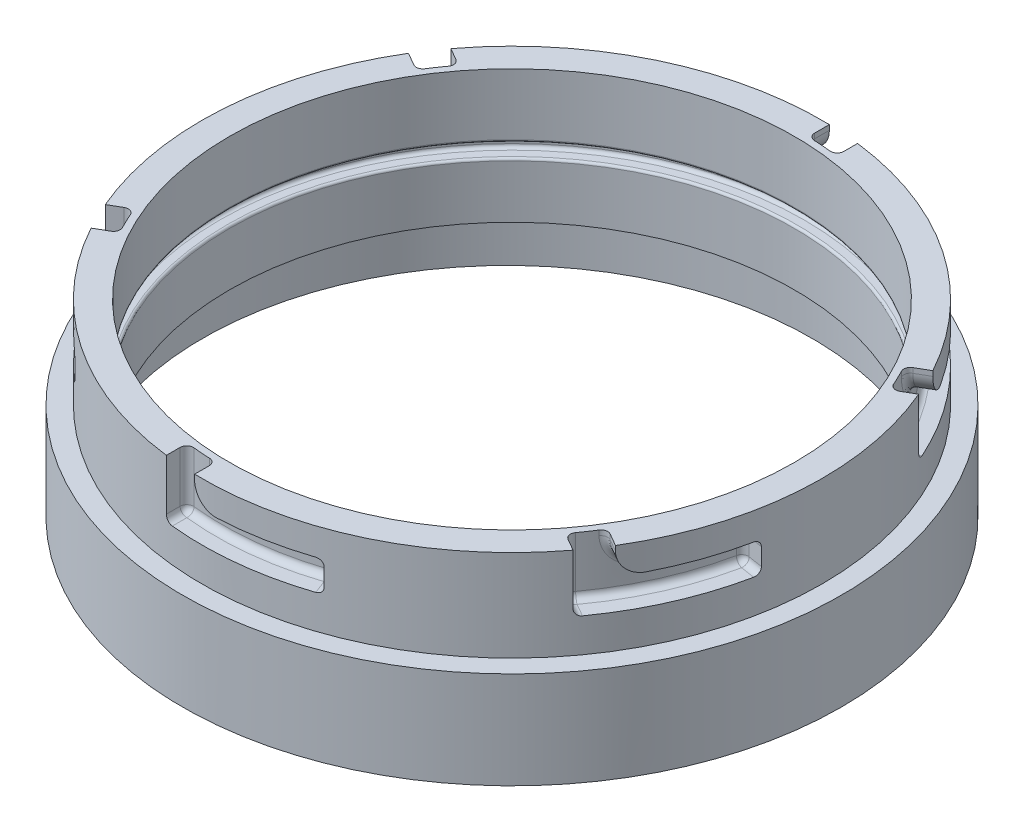
from build123d import *

# Parameters (mm, degrees)
CUT_EXTRUDE1_START       = -13.207999999999998
CUT_EXTRUDE1_DEPTH       = 13.207999999999998
SKETCH10_W               = 4.827435186195032
SKETCH10_H               = 6.984999999999999
FILLET1_R                = 5.08
FILLET7_R                = 1.524
CIRPATTERN1_COUNT        = 6
FILLET1_OF_CIRPATTERN1_R = 5.08
FILLET7_OF_CIRPATTERN1_R = 1.524
FILLET2_R                = 0.762
FILLET3_R                = 0.508
BOSS_EXTRUDE1_START      = 12.7
SKETCH25_R               = 75.565
SKETCH25_R_2             = 69.85
BOSS_EXTRUDE1_DEPTH      = 12.7


with BuildPart() as part:
    # Sketch1 → Revolve1 (revolve)
    with BuildSketch(Plane.XY):
        Polygon((71.11999999999999, 36.51250000000001), (71.11999999999999, 15.557500000000015), (75.56500000000001, 15.557500000000017), (75.565, 6.032500000000017), (64.77000000000001, 6.032500000000014), (64.77000000000001, 18.732500000000012), (67.81799999999998, 18.732500000000012), (67.81799999999998, 21.907500000000017), (64.77, 21.907500000000013), (64.77, 36.51250000000001), align=None)
    revolve(axis=Axis((0, 60.75795454545431, 0), (1.2e-16, -1, 0)))

    # Sketch2 → Cut-Extrude1 (cut)
    with BuildSketch(Plane(origin=(-4.47e-15, 36.5125, 0), x_dir=(1, 1.2e-16, 0), z_dir=(-1.2e-16, 1, 0)).offset(CUT_EXTRUDE1_START)):
        with BuildLine():
            Line((-8.659215820595662, -70.59088029889091), (-8.659215820595662, -65.7260406336206))
            ThreePointArc((-8.659215820595662, -65.7260406336206), (-5.173944735082208, -66.09179020028368), (-1.6742158205956637, -66.27285596219667))
            Line((-1.6742158205956637, -66.27285596219667), (-1.6742158205956637, -71.1002911483917))
            ThreePointArc((-1.6742158205956637, -71.1002911483917), (-5.172990162777308, -70.93161899164441), (-8.659215820595662, -70.59088029889091))
        make_face()
    cut_extrude1 = extrude(amount=CUT_EXTRUDE1_DEPTH, mode=Mode.SUBTRACT)

    # Cut-Sweep2: sweep along a path in Sketch23
    with BuildLine(Plane(origin=(-2.85e-15, 23.304500000000004, 0), x_dir=(1, 1.2e-16, 0), z_dir=(-1.2e-16, 1, 0))) as cut_sweep2_path:
        ThreePointArc((-1.6742158205956639, -71.1002911483917), (11.313422517678514, -70.21439219231685), (23.92201927626626, -66.97605089691348))
    # Sketch10 → Cut-Sweep2 (sweep, cut)
    with BuildSketch(Plane.ZY.offset(1.6742158205956639)):
        with Locations((68.68657355529419, 26.797000000000008)):
            Rectangle(SKETCH10_W, SKETCH10_H)
    cut_sweep2 = sweep(path=cut_sweep2_path.line, mode=Mode.SUBTRACT)

    # Fillet1
    fillet1_edges = [part.edges().sort_by_distance(p)[0] for p in [
        (-1.6742158205956676, 30.289500000000007, 68.68657355529419),
    ]]
    fillet(fillet1_edges, radius=FILLET1_R)

    # Fillet7
    fillet7_edges = [part.edges().sort_by_distance(p)[0] for p in [
        (-1.6742158205956668, 35.941, 66.27285596219667),
        (-0.18582286684972038, 31.776902176794007, 66.29373957046366),
        (23.05685308016756, 23.304500000000004, 64.72271557513899),
        (-8.659215820595666, 23.304500000000004, 68.15846046625575),
        (23.05685308016756, 30.289500000000007, 64.72271557513899),
        (22.191686884068872, 26.797000000000004, 62.46938025336449),
        (12.934414118168412, 30.289500000000007, 65.01996129974029),
        (6.95941107271422, 23.304500000000004, 65.92769549681668),
        (-8.659215820595668, 29.908500000000004, 65.7260406336206),
    ]]
    fillet(fillet7_edges, radius=FILLET7_R)

    # CirPattern1: Cut-Extrude1, Cut-Sweep2 ×6 about axis
    cirpattern1_axis = Axis((0, 60.75795454545431, 0), (-1.2e-16, 1, 0))
    add([cut_extrude1.rotate(cirpattern1_axis, i * 360 / CIRPATTERN1_COUNT) for i in range(1, CIRPATTERN1_COUNT)], mode=Mode.SUBTRACT)
    add([cut_sweep2.rotate(cirpattern1_axis, i * 360 / CIRPATTERN1_COUNT) for i in range(1, CIRPATTERN1_COUNT)], mode=Mode.SUBTRACT)

    # Fillet1 of CirPattern1
    fillet1_of_cirpattern1_edges = [part.edges().sort_by_distance(p)[0] for p in [
        (58.64720968749536, 30.289500000000015, 35.793200209700764),
        (60.321425508091046, 30.289500000000015, -32.89337334559342),
        (1.6742158205956834, 30.289500000000007, -68.68657355529419),
        (-58.647209687495334, 30.2895, -35.793200209700785),
        (-60.321425508091025, 30.2895, 32.89337334559344),
    ]]
    fillet(fillet1_of_cirpattern1_edges, radius=FILLET1_OF_CIRPATTERN1_R)

    # Fillet7 of CirPattern1
    fillet7_of_cirpattern1_edges = [part.edges().sort_by_distance(p)[0] for p in [
        (56.55686893431148, 35.94100000000001, 34.586341413152006),
        (57.31915114646635, 31.776902176794014, 33.30779710852775),
        (67.5799424300689, 23.30450000000001, 12.393537288818921),
        (54.697350336316994, 23.30450000000001, 41.57833111061584),
        (67.5799424300689, 30.289500000000015, 12.39353728881892),
        (65.19591370011806, 26.797000000000008, 12.016125532248683),
        (62.776145297740364, 30.289500000000015, 21.308449440468213),
        (60.574764649565296, 23.30450000000001, 26.936820964059127),
        (52.590812968585865, 29.90850000000001, 40.362121194298275),
        (58.23108475490716, 35.94100000000001, -31.68651454904466),
        (57.50497401331608, 31.776902176794014, -32.9859424619359),
        (44.52308934990136, 23.304500000000008, -52.329178286320065),
        (63.35656615691267, 23.30450000000001, -26.580129355639894),
        (44.52308934990136, 30.28950000000001, -52.329178286320065),
        (43.004226816049204, 26.797000000000008, -50.453254721115805),
        (49.841731179571966, 30.28950000000001, -43.71151185927207),
        (53.615353576851085, 23.30450000000001, -38.990874532757545),
        (61.25002878918154, 29.90850000000001, -25.36391943932232),
        (1.674215820595681, 35.941, -66.27285596219667),
        (0.1858228668497356, 31.776902176794007, -66.29373957046366),
        (-23.056853080167542, 23.304499999999997, -64.72271557513899),
        (8.659215820595682, 23.304500000000008, -68.15846046625575),
        (-23.056853080167546, 30.2895, -64.72271557513899),
        (-22.191686884068858, 26.796999999999997, -62.46938025336449),
        (-12.934414118168398, 30.289500000000004, -65.01996129974029),
        (-6.959411072714202, 23.304500000000004, -65.92769549681668),
        (8.659215820595682, 29.908500000000007, -65.7260406336206),
        (-56.55686893431146, 35.940999999999995, -34.58634141315203),
        (-57.319151146466325, 31.776902176794, -33.30779710852777),
        (-67.57994243006888, 23.304499999999994, -12.393537288818946),
        (-54.697350336316966, 23.304499999999997, -41.57833111061586),
        (-67.57994243006888, 30.289499999999997, -12.393537288818944),
        (-65.19591370011804, 26.796999999999993, -12.016125532248708),
        (-62.77614529774034, 30.289499999999997, -21.308449440468237),
        (-60.57476464956527, 23.304499999999997, -26.93682096405915),
        (-52.59081296858584, 29.908499999999997, -40.36212119429829),
        (-58.231084754907144, 35.940999999999995, 31.686514549044684),
        (-57.50497401331606, 31.776902176794, 32.98594246193592),
        (-44.52308934990133, 23.304499999999997, 52.32917828632009),
        (-63.356566156912656, 23.304499999999997, 26.580129355639915),
        (-44.52308934990133, 30.2895, 52.32917828632009),
        (-43.004226816049176, 26.796999999999997, 50.45325472111582),
        (-49.841731179571944, 30.2895, 43.711511859272086),
        (-53.615353576851064, 23.304499999999997, 38.990874532757566),
        (-61.25002878918153, 29.908499999999997, 25.36391943932234),
    ]]
    fillet(fillet7_of_cirpattern1_edges, radius=FILLET7_OF_CIRPATTERN1_R)

    # Fillet2
    fillet2_edges = [part.edges().sort_by_distance(p)[0] for p in [
        (-67.81799999999998, 21.9075, 8.31e-15),
        (-67.81799999999998, 18.7325, 8.31e-15),
    ]]
    fillet(fillet2_edges, radius=FILLET2_R)

    # Fillet3
    fillet3_edges = [part.edges().sort_by_distance(p)[0] for p in [
        (-64.77000000000001, 18.7325, 7.93e-15),
        (-64.77, 21.9075, 7.93e-15),
    ]]
    fillet(fillet3_edges, radius=FILLET3_R)

    # Sketch25 → Boss-Extrude1 (add)
    with BuildSketch(Plane.XZ.offset(-6.032500000000007).offset(BOSS_EXTRUDE1_START)):
        Circle(SKETCH25_R)
        with Locations((-1.0614183153165868, 0)):
            Circle(SKETCH25_R_2, mode=Mode.SUBTRACT)
    extrude(amount=-BOSS_EXTRUDE1_DEPTH)


solid = part.part
